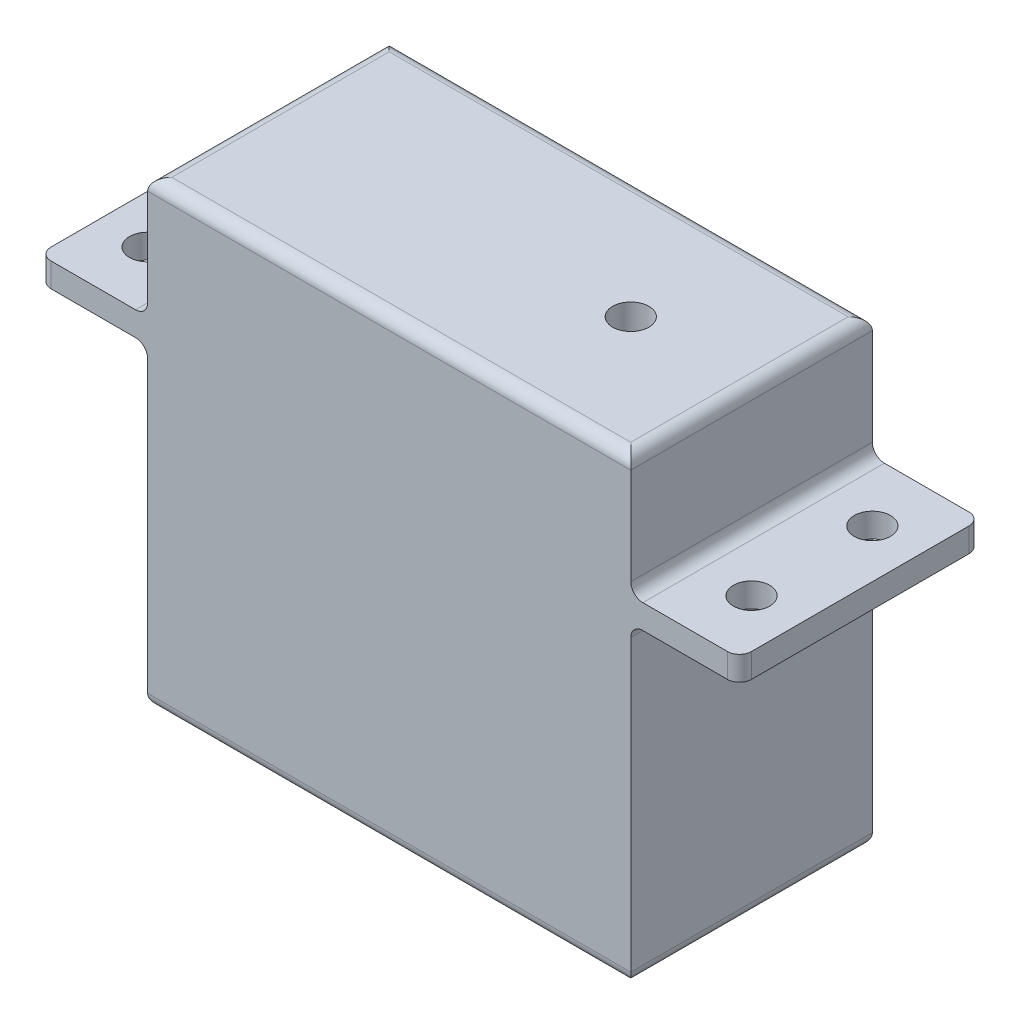
from build123d import *

# Parameters (mm, degrees)
SKETCH1_W           = 40
SKETCH1_H           = 20
BOSS_EXTRUDE1_DEPTH = 38
SKETCH2_R           = 1.5
CUT_EXTRUDE1_DEPTH  = 10
SKETCH3_W           = 20
SKETCH3_H           = 2
BOSS_EXTRUDE2_DEPTH = 9
SKETCH6_R           = 1.5
CUT_EXTRUDE2_DEPTH  = 41.82341542
SKETCH7_W           = 20
SKETCH7_H           = 2
BOSS_EXTRUDE5_DEPTH = 9
SKETCH8_R           = 1.504714294
CUT_EXTRUDE3_DEPTH  = 45.405116872
FILLET1_R           = 1


with BuildPart() as part:
    # Sketch1 → Boss-Extrude1 (new body)
    with BuildSketch(Plane(origin=(0, 0, 0), x_dir=(1, 0, 0), z_dir=(0, 1, 0))):
        with Locations((-2.631578947, -3.684210526)):
            Rectangle(SKETCH1_W, SKETCH1_H)
    extrude(amount=BOSS_EXTRUDE1_DEPTH)

    # Sketch2 → Cut-Extrude1 (cut)
    with BuildSketch(Plane(origin=(0, 38, 0), x_dir=(1, 0, 0), z_dir=(0, 1, 0))):
        with Locations(Location((7.368421053, -3.684210526, 0), (0, 0, 270))):
            Circle(SKETCH2_R)
    extrude(amount=-CUT_EXTRUDE1_DEPTH, mode=Mode.SUBTRACT)

    # Sketch3 → Boss-Extrude2 (add)
    with BuildSketch(Plane(origin=(17.368421053, 0, 0), x_dir=(0, 0, -1), z_dir=(1, 0, 0))):
        with Locations((-3.684210526, 27)):
            Rectangle(SKETCH3_W, SKETCH3_H)
    extrude(amount=BOSS_EXTRUDE2_DEPTH)

    # Sketch6 → Cut-Extrude2 (cut, through all)
    with BuildSketch(Plane(origin=(0, 28, 0), x_dir=(1, 0, 0), z_dir=(0, 1, 0))):
        with Locations(Location((22.368421053, 1.315789474, 0), (0, 0, 270))):
            Circle(SKETCH6_R)
        with Locations(Location((22.368421053, -8.684210526, 0), (0, 0, 270))):
            Circle(SKETCH6_R)
    extrude(amount=-CUT_EXTRUDE2_DEPTH, mode=Mode.SUBTRACT)

    # Sketch7 → Boss-Extrude5 (add)
    with BuildSketch(Plane.ZY.offset(22.631578947)):
        with Locations((3.684210526, 27)):
            Rectangle(SKETCH7_W, SKETCH7_H)
    extrude(amount=BOSS_EXTRUDE5_DEPTH)

    # Sketch8 → Cut-Extrude3 (cut, through all)
    with BuildSketch(Plane(origin=(0, 28, 0), x_dir=(1, 0, 0), z_dir=(0, 1, 0))):
        with Locations(Location((-27.631578947, 1.315789474, 0), (0, 0, 270))):
            Circle(SKETCH8_R)
        with Locations(Location((-27.631578947, -8.684210526, 0), (0, 0, 270))):
            Circle(SKETCH8_R)
    extrude(amount=-CUT_EXTRUDE3_DEPTH, mode=Mode.SUBTRACT)

    # Fillet1
    fillet1_edges = [part.edges().sort_by_distance(p)[0] for p in [
        (17.368421053, 38, 3.684210526),
        (-2.631578947, 38, -6.315789474),
        (17.368421053, 26, 3.684210526),
        (26.368421053, 27, 13.684210526),
        (26.368421053, 27, -6.315789474),
        (17.368421053, 28, 3.684210526),
        (-22.631578947, 38, 3.684210526),
        (-2.631578947, 0, -6.315789474),
        (17.368421053, 0, 3.684210526),
        (-22.631578947, 26, 3.684210526),
        (-31.631578947, 27, -6.315789474),
        (-31.631578947, 27, 13.684210526),
        (-22.631578947, 28, 3.684210526),
        (-2.631578947, 0, 13.684210526),
        (-22.631578947, 0, 3.684210526),
        (-2.631578947, 38, 13.684210526),
    ]]
    fillet(fillet1_edges, radius=FILLET1_R)


solid = part.part
